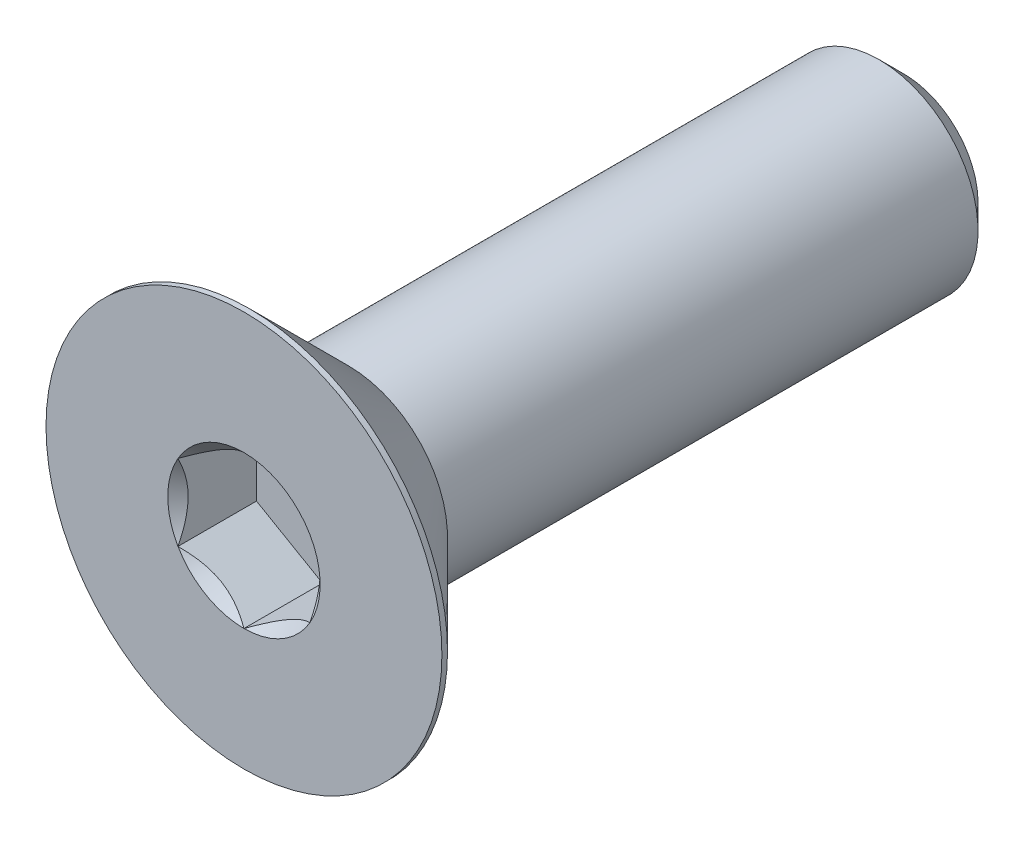
from build123d import *

# Parameters (mm, degrees)
CHAMFER1_SIZE      = 0.375
CUT_EXTRUDE2_DEPTH = 1.19


with BuildPart() as part:
    # Sketch1 → Revolve1 (revolve)
    with BuildSketch(Plane(origin=(0, 0, 0), x_dir=(0, 0, -1), z_dir=(1, 0, 0)), mode=Mode.PRIVATE) as revolve1_sk:
        Polygon((-3.3, 1.5), (5, 1.5), (5, 0), (-3.81, 0), (-3.81, 1.5), align=None)
    revolve(revolve1_sk.sketch.rotate(Axis((0, 0, 3.81), (0, 0, -1)), 180), axis=Axis((0, 0, 3.81), (0, 0, -1)))

    # Chamfer1
    chamfer1_edges = [part.edges().sort_by_distance(p)[0] for p in [
        (0, 1.5, -5),
    ]]
    chamfer(chamfer1_edges, length=CHAMFER1_SIZE)


with BuildPart() as body_2:
    # Sketch7 → Revolve2 (revolve)
    with BuildSketch(Plane(origin=(0, 0, 0), x_dir=(0, 0, -1), z_dir=(1, 0, 0)), mode=Mode.PRIVATE) as revolve2_sk:
        Polygon((-5, 3), (-4.915, 3), (-3.3, 1.385), (-3.3, 0), (-5, 0), align=None)
    revolve(revolve2_sk.sketch.rotate(Axis((0, 0, 5), (0, 0, -1)), 180), axis=Axis((0, 0, 5), (0, 0, -1)))

    # Sketch5 → Cut-Extrude2 (cut)
    with BuildSketch(Plane.XY.offset(5)):
        Polygon((1, -0.577350269), (1, 0.577350269), (0, 1.154700538), (-1, 0.577350269), (-1, -0.577350269), (0, -1.154700538), align=None)
    extrude(amount=-CUT_EXTRUDE2_DEPTH, mode=Mode.SUBTRACT)

    # Cut-Extrude3 cone 1 section (through the dimple's axis) → Cut-Extrude3 (revolve, cut)
    with BuildSketch(Plane(origin=(0, 0, 5), x_dir=(0, -1, 0), z_dir=(1, 0, 0))):
        Polygon((0, 0), (1.154700538, 0), (0, 1.154700538), align=None)
    revolve(axis=Axis((0, 0, 5), (0, 0, -1)), mode=Mode.SUBTRACT)

    # Combine1: union part
    add(part.part)


solid = body_2.part
